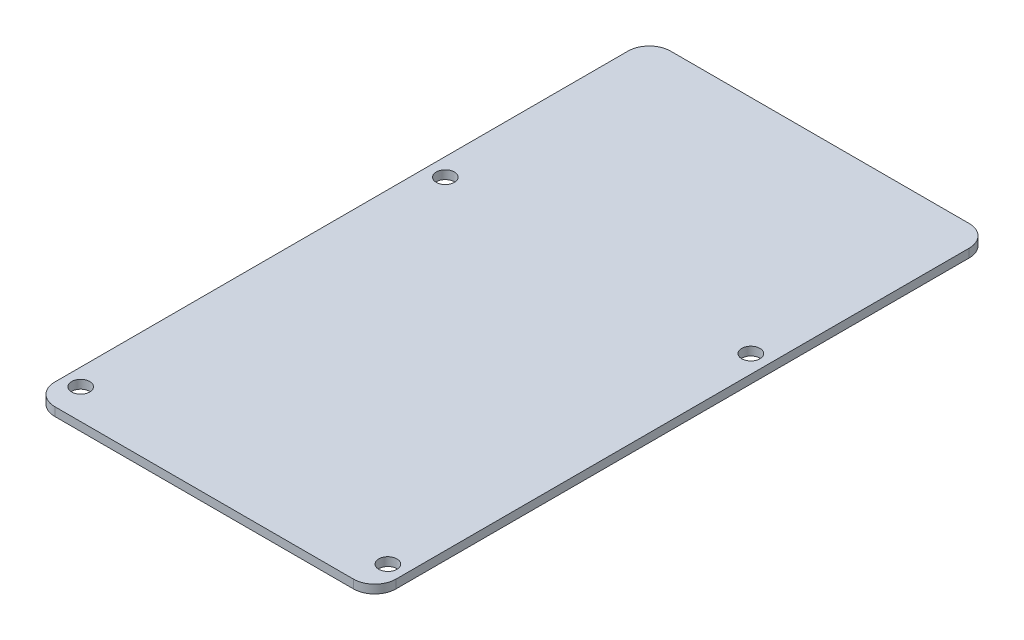
from build123d import *

# Parameters (mm, degrees)
SKETCH1_R           = 2.125
BOSS_EXTRUDE1_DEPTH = 2


with BuildPart() as part:
    # Sketch1 → Boss-Extrude1 (new body)
    with BuildSketch(Plane(origin=(0, 0, 0), x_dir=(-1, 0, 0), z_dir=(0, 1, 0))):
        with BuildLine():
            Line((44.041758229, -68.058283539), (44.041758229, 66.305377739))
            ThreePointArc((44.041758229, 66.305377739), (42.577292135, 69.840911645), (39.041758229, 71.305377739))
            Line((39.041758229, 71.305377739), (-30.958241771, 71.305377739))
            ThreePointArc((-30.958241771, 71.305377739), (-34.493775676, 69.840911645), (-35.958241771, 66.305377739))
            Line((-35.958241771, 66.305377739), (-35.958241771, -68.058283539))
            ThreePointArc((-35.958241771, -68.058283539), (-34.493775676, -71.593817445), (-30.958241771, -73.058283539))
            Line((-30.958241771, -73.058283539), (39.041758229, -73.058283539))
            ThreePointArc((39.041758229, -73.058283539), (42.577292135, -71.593817445), (44.041758229, -68.058283539))
        make_face()
        with Locations(Location((-31.767919032, -21.058283539, 0), (0, 0, 90))):
            Circle(SKETCH1_R, mode=Mode.SUBTRACT)
        with Locations(Location((39.851435491, -21.058283539, 0), (0, 0, 90))):
            Circle(SKETCH1_R, mode=Mode.SUBTRACT)
        with Locations(Location((40.041758229, 64.22705795, 0), (0, 0, 90))):
            Circle(SKETCH1_R, mode=Mode.SUBTRACT)
        with Locations(Location((-31.958241771, 64.22705795, 0), (0, 0, 90))):
            Circle(SKETCH1_R, mode=Mode.SUBTRACT)
    extrude(amount=BOSS_EXTRUDE1_DEPTH)


solid = part.part
